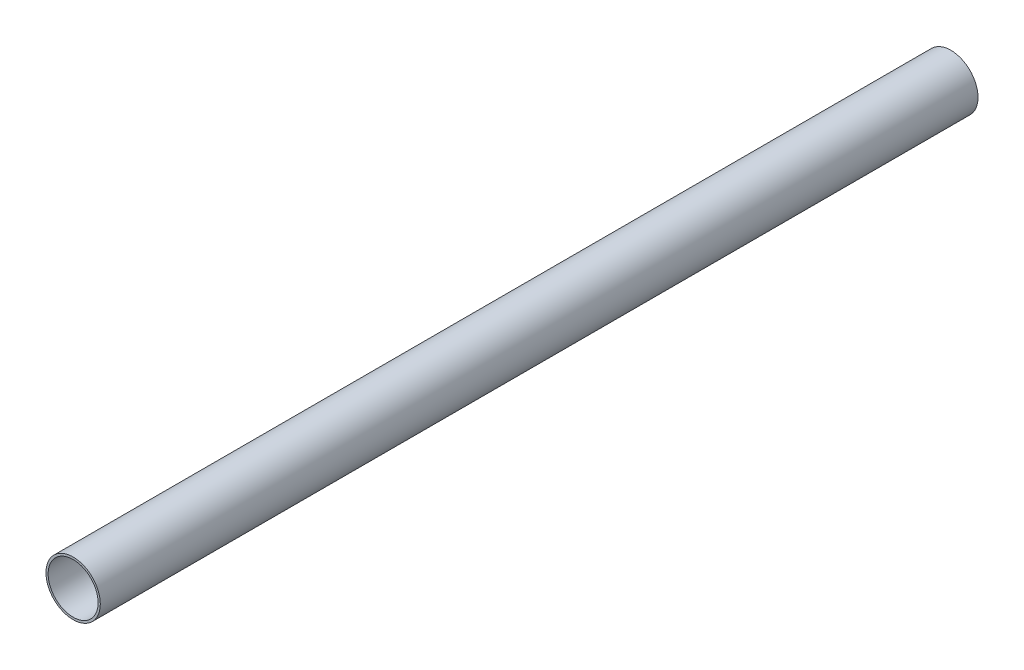
from build123d import *

# Parameters (mm, degrees)
SKETCH1_R           = 12.5
SKETCH1_R_2         = 11.5
BOSS_EXTRUDE1_DEPTH = 403.72


with BuildPart() as part:
    # Sketch1 → Boss-Extrude1 (new body)
    with BuildSketch(Plane.XY):
        Circle(SKETCH1_R)
        Circle(SKETCH1_R_2, mode=Mode.SUBTRACT)
    extrude(amount=BOSS_EXTRUDE1_DEPTH)


solid = part.part
